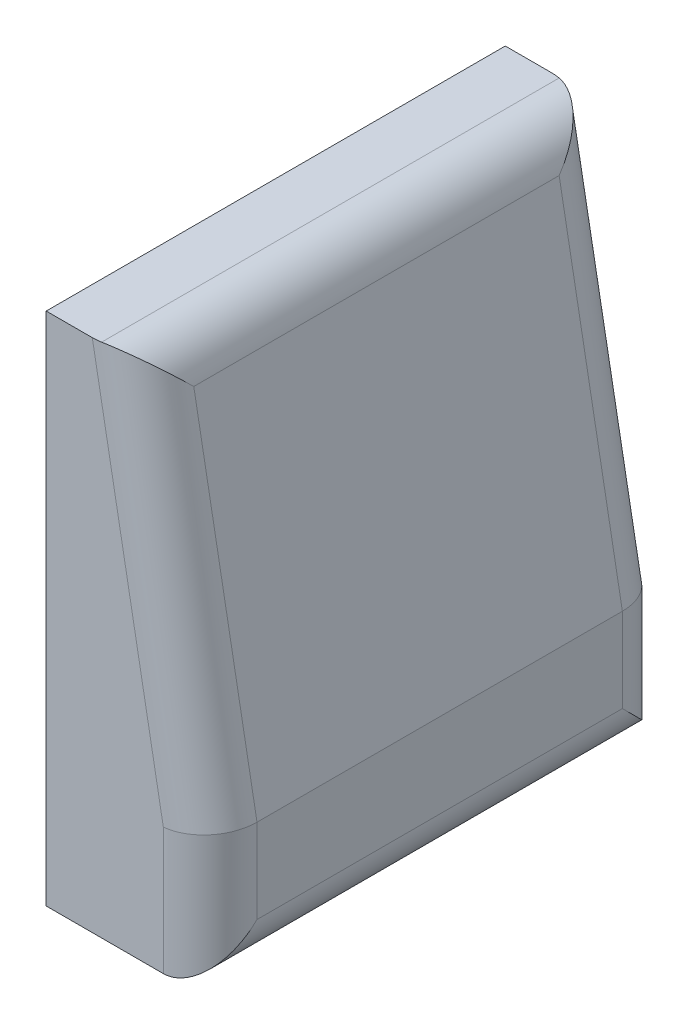
from build123d import *

# Parameters (mm, degrees)
BOSS_EXTRUDE1_DEPTH = 490
FILLET1_R           = 100


with BuildPart() as part:
    # Sketch1 → Boss-Extrude1 (new, symmetric)
    with BuildSketch(Plane.XY):
        Polygon((175, -442.105263158), (175, -162.105263158), (25, 657.894736842), (-175, 657.894736842), (-175, -442.105263158), align=None)
    extrude(amount=BOSS_EXTRUDE1_DEPTH, both=True)

    # Fillet1
    fillet1_edges = [part.edges().sort_by_distance(p)[0] for p in [
        (175, -302.105263158, 490),
        (100, 247.894736842, 490),
        (100, 247.894736842, -490),
        (175, -302.105263158, -490),
        (25, 657.894736842, 0),
        (175, -442.105263158, 0),
    ]]
    fillet(fillet1_edges, radius=FILLET1_R)


solid = part.part
